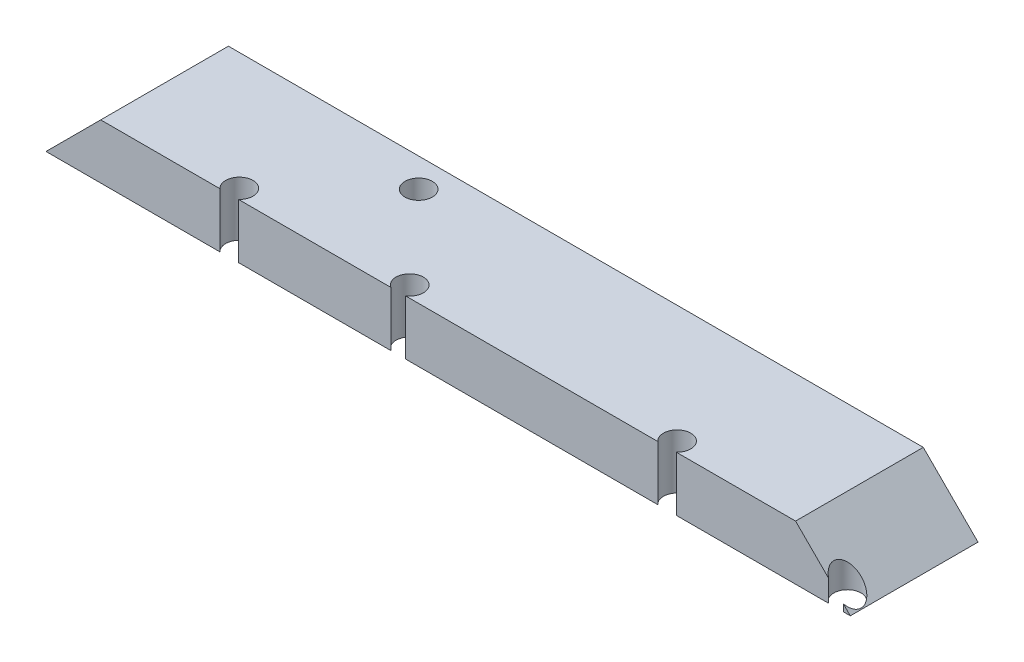
from build123d import *

# Parameters (mm, degrees)
SKETCH1_W                   = 560
SKETCH1_H                   = 88.9
BODY_DEPTH                  = 38.1
MOUNTING_HOLE_SPACING_REACH = 570.291
SKETCH2_R                   = 9.525
CUT_EXTRUDE1_REACH          = 570.291


with BuildPart() as part:
    # Sketch1 → Body (new body)
    with BuildSketch(Plane(origin=(0, 0, 0), x_dir=(1, 0, 0), z_dir=(0, 1, 0))):
        with Locations((280, 44.45)):
            Rectangle(SKETCH1_W, SKETCH1_H)
    extrude(amount=BODY_DEPTH)

    # Sketch2 → Mounting hole spacing (cut, up to next)
    with BuildSketch(Plane(origin=(0, 38.1, 0), x_dir=(1, 0, 0), z_dir=(0, 1, 0)), mode=Mode.PRIVATE) as mounting_hole_spacing_sk1:
        with Locations((127.6, 7)):
            Circle(SKETCH2_R)
    mounting_hole_spacing_tool1 = extrude(mounting_hole_spacing_sk1.sketch, amount=-MOUNTING_HOLE_SPACING_REACH, mode=Mode.PRIVATE) & part.part
    # Sketch2 → Mounting hole spacing (cut, up to next)
    with BuildSketch(Plane(origin=(0, 38.1, 0), x_dir=(1, 0, 0), z_dir=(0, 1, 0)), mode=Mode.PRIVATE) as mounting_hole_spacing_sk2:
        with Locations(Location((190.57, 68.87, 0), (0, 0, 270))):
            Circle(SKETCH2_R)
    mounting_hole_spacing_tool2 = extrude(mounting_hole_spacing_sk2.sketch, amount=-MOUNTING_HOLE_SPACING_REACH, mode=Mode.PRIVATE) & part.part
    # Sketch2 → Mounting hole spacing (cut, up to next)
    with BuildSketch(Plane(origin=(0, 38.1, 0), x_dir=(1, 0, 0), z_dir=(0, 1, 0)), mode=Mode.PRIVATE) as mounting_hole_spacing_sk3:
        with Locations(Location((10, 68.87, 0), (0, 0, 270))):
            Circle(SKETCH2_R)
    mounting_hole_spacing_tool3 = extrude(mounting_hole_spacing_sk3.sketch, amount=-MOUNTING_HOLE_SPACING_REACH, mode=Mode.PRIVATE) & part.part
    # Sketch2 → Mounting hole spacing (cut, up to next)
    with BuildSketch(Plane(origin=(0, 38.1, 0), x_dir=(1, 0, 0), z_dir=(0, 1, 0)), mode=Mode.PRIVATE) as mounting_hole_spacing_sk4:
        with Locations((245.2, 8.02)):
            Circle(SKETCH2_R)
    mounting_hole_spacing_tool4 = extrude(mounting_hole_spacing_sk4.sketch, amount=-MOUNTING_HOLE_SPACING_REACH, mode=Mode.PRIVATE) & part.part
    # Sketch2 → Mounting hole spacing (cut, up to next)
    with BuildSketch(Plane(origin=(0, 38.1, 0), x_dir=(1, 0, 0), z_dir=(0, 1, 0)), mode=Mode.PRIVATE) as mounting_hole_spacing_sk5:
        with Locations((550, 8.02)):
            Circle(SKETCH2_R)
    mounting_hole_spacing_tool5 = extrude(mounting_hole_spacing_sk5.sketch, amount=-MOUNTING_HOLE_SPACING_REACH, mode=Mode.PRIVATE) & part.part
    # Sketch2 → Mounting hole spacing (cut, up to next)
    with BuildSketch(Plane(origin=(0, 38.1, 0), x_dir=(1, 0, 0), z_dir=(0, 1, 0)), mode=Mode.PRIVATE) as mounting_hole_spacing_sk6:
        with Locations((432.4, 7)):
            Circle(SKETCH2_R)
    mounting_hole_spacing_tool6 = extrude(mounting_hole_spacing_sk6.sketch, amount=-MOUNTING_HOLE_SPACING_REACH, mode=Mode.PRIVATE) & part.part
    add(mounting_hole_spacing_tool1.solids().sort_by_distance((127.6, 38.1, -7))[0], mode=Mode.SUBTRACT)
    add(mounting_hole_spacing_tool2.solids().sort_by_distance((190.57, 38.1, -68.87))[0], mode=Mode.SUBTRACT)
    add(mounting_hole_spacing_tool3.solids().sort_by_distance((10, 38.1, -68.87))[0], mode=Mode.SUBTRACT)
    add(mounting_hole_spacing_tool4.solids().sort_by_distance((245.2, 38.1, -8.02))[0], mode=Mode.SUBTRACT)
    add(mounting_hole_spacing_tool5.solids().sort_by_distance((550, 38.1, -8.02))[0], mode=Mode.SUBTRACT)
    add(mounting_hole_spacing_tool6.solids().sort_by_distance((432.4, 38.1, -7))[0], mode=Mode.SUBTRACT)

    # Sketch3 → Cut-Extrude1 (cut, up to next)
    with BuildSketch(Plane(origin=(0, 0, -88.9), x_dir=(-1, 0, 0), z_dir=(0, 0, -1)), mode=Mode.PRIVATE) as cut_extrude1_sk1:
        Polygon((-560, 0), (-521.9, 38.1), (-560, 38.1), align=None)
    cut_extrude1_tool1 = extrude(cut_extrude1_sk1.sketch, amount=-CUT_EXTRUDE1_REACH, mode=Mode.PRIVATE) & part.part
    # Sketch3 → Cut-Extrude1 (cut, up to next)
    with BuildSketch(Plane(origin=(0, 0, -88.9), x_dir=(-1, 0, 0), z_dir=(0, 0, -1)), mode=Mode.PRIVATE) as cut_extrude1_sk2:
        Polygon((0, 38.1), (0, 0), (-38.1, 38.1), align=None)
    cut_extrude1_tool2 = extrude(cut_extrude1_sk2.sketch, amount=-CUT_EXTRUDE1_REACH, mode=Mode.PRIVATE) & part.part
    add(cut_extrude1_tool1.solids().sort_by_distance((547.3, 25.4, -88.9))[0], mode=Mode.SUBTRACT)
    add(cut_extrude1_tool2.solids().sort_by_distance((12.7, 25.4, -88.9))[0], mode=Mode.SUBTRACT)


solid = part.part
